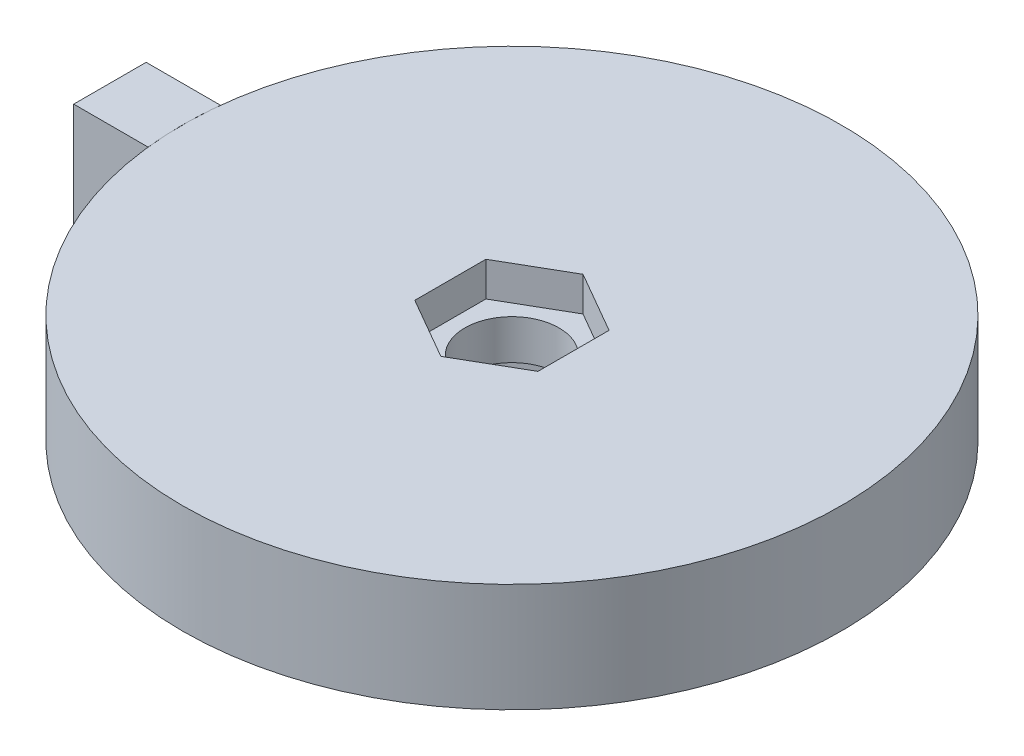
from build123d import *

# Parameters (mm, degrees)
ESQUISSE1_R             = 45.5
BOSS_EXTRU_1_DEPTH      = 15
BOSS_EXTRU_2_DEPTH      = 15
ESQUISSE3_R             = 6.5
ENL_V_MAT_EXTRU_1_DEPTH = 74.317801385
ENL_V_MAT_EXTRU_3_DEPTH = 4.75
ENL_V_MAT_EXTRU_4_DEPTH = 4.75


with BuildPart() as part:
    # Esquisse1 → Boss.-Extru.1 (new body)
    with BuildSketch(Plane(origin=(0, 0, 0), x_dir=(1, 0, 0), z_dir=(0, 1, 0))):
        with Locations(Location((0, 0, 0), (0, 0, 270))):
            Circle(ESQUISSE1_R)
    extrude(amount=BOSS_EXTRU_1_DEPTH)

    # Esquisse3 → Enlèv. mat.-Extru.1 (cut, through all)
    with BuildSketch(Plane(origin=(0, 15, 0), x_dir=(1, 0, 0), z_dir=(0, 1, 0))):
        with Locations(Location((0, 0, 0), (0, 0, 270))):
            Circle(ESQUISSE3_R)
    extrude(amount=-ENL_V_MAT_EXTRU_1_DEPTH, mode=Mode.SUBTRACT)

    # Esquisse4 → Enlèv. mat.-Extru.3 (cut)
    with BuildSketch(Plane(origin=(0, 15, 0), x_dir=(1, 0, 0), z_dir=(0, 1, 0))):
        Polygon((4.25, 7.361215932), (0, 9.814954576), (-4.25, 7.361215932), (-8.5, 4.907477288), (-8.5, 0), (-8.5, -4.907477288), (-4.25, -7.361215932), (0, -9.814954576), (4.25, -7.361215932), (8.5, -4.907477288), (8.5, 0), (8.5, 4.907477288), align=None)
    extrude(amount=-ENL_V_MAT_EXTRU_3_DEPTH, mode=Mode.SUBTRACT)

    # Esquisse5 → Enlèv. mat.-Extru.4 (cut)
    with BuildSketch(Plane.XZ):
        Polygon((-8.5, 4.907477288), (0, 9.814954576), (8.5, 4.907477288), (8.5, -4.907477288), (0, -9.814954576), (-8.5, -4.907477288), align=None)
    extrude(amount=-ENL_V_MAT_EXTRU_4_DEPTH, mode=Mode.SUBTRACT)


with BuildPart() as body_2:
    # Esquisse2 → Boss.-Extru.2 (new body)
    with BuildSketch(Plane.XZ):
        with BuildLine():
            ThreePointArc((-45.224440295, -5), (-45.431057843, -2.503793779), (-45.5, 0))
            Line((-45.5, 0), (-55.5, 0))
            Line((-55.5, 0), (-55.5, -5))
            Line((-55.5, -5), (-45.224440295, -5))
        make_face()
        with BuildLine():
            Line((-55.5, 0), (-45.5, 0))
            ThreePointArc((-45.5, 0), (-45.431057843, 2.503793779), (-45.224440295, 5))
            Line((-45.224440295, 5), (-55.5, 5))
            Line((-55.5, 5), (-55.5, 0))
        make_face()
    extrude(amount=-BOSS_EXTRU_2_DEPTH)


solid = Compound([part.part, body_2.part])
